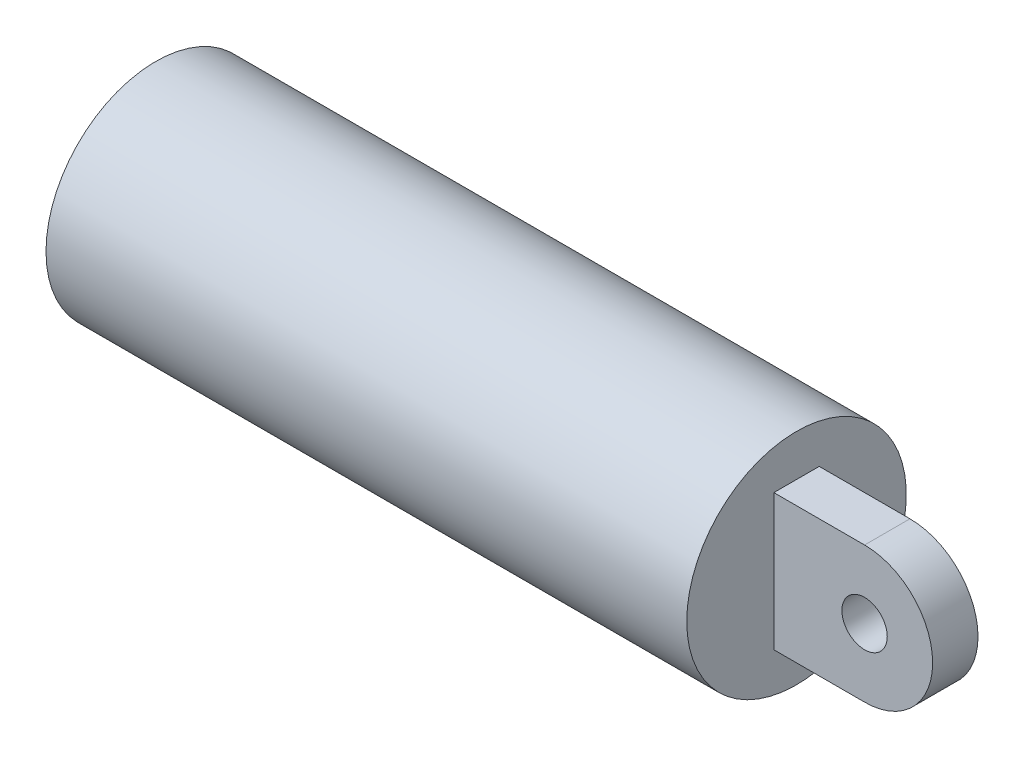
from build123d import *

# Parameters (mm, degrees)
SKETCH1_R           = 5
BOSS_EXTRUDE1_DEPTH = 5


with BuildPart() as part:
    # Sketch1 → Boss-Extrude1 (new, symmetric)
    with BuildSketch(Plane.XY):
        with BuildLine():
            Line((320, 39), (300, 39))
            Line((300, 39), (300, 9))
            Line((300, 9), (320, 9))
            ThreePointArc((320, 9), (335, 24), (320, 39))
        make_face()
        with Locations((320, 24)):
            Circle(SKETCH1_R, mode=Mode.SUBTRACT)
    extrude(amount=BOSS_EXTRUDE1_DEPTH, both=True)

    # Sketch4 → Revolve2 (revolve)
    with BuildSketch(Plane.XY, mode=Mode.PRIVATE) as revolve2_sk:
        Polygon((300, 39), (300, 48.198468166), (158.764392762, 48.198468166), (158.764392762, 39), (289.025351805, 39), (289.025351805, 24), (300, 24), align=None)
    revolve(revolve2_sk.sketch.rotate(Axis((289.025351805, 24, 0), (1, 0, 0)), 90), axis=Axis((289.025351805, 24, 0), (1, 0, 0)))


solid = part.part
